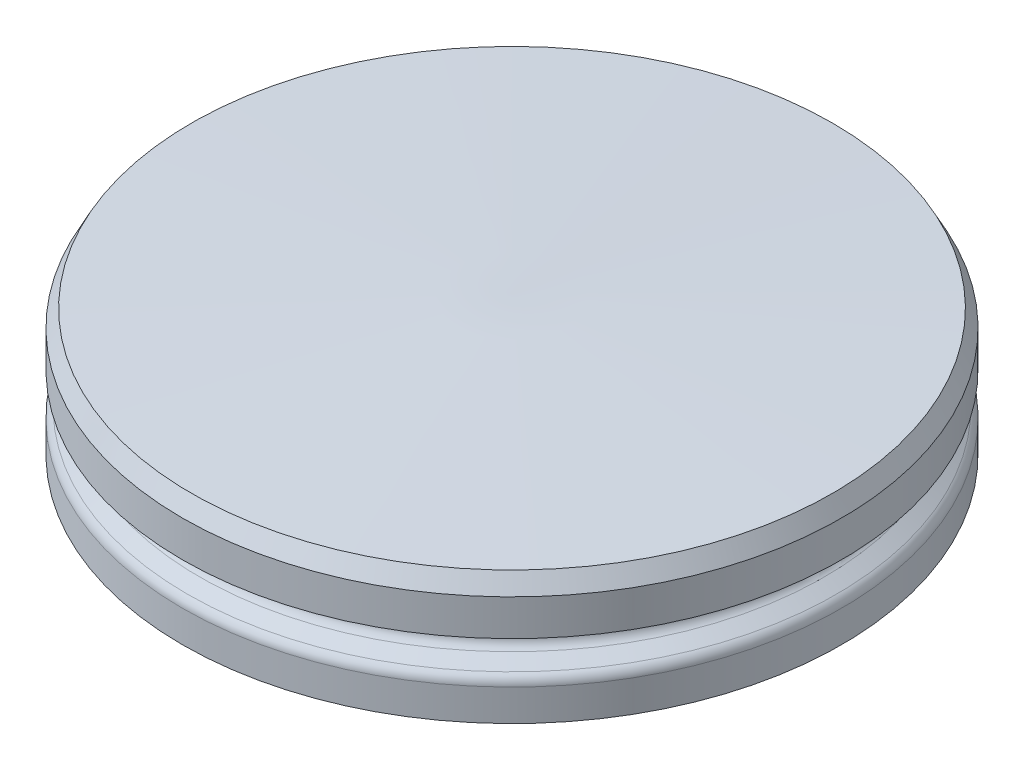
from build123d import *

# Parameters (mm, degrees)
FILLET1_R      = 2.54
CHAMFER1_SIZE  = 1.905
CHAMFER1_SIZE2 = 3.544462864


with BuildPart() as part:
    # Sketch1 → Revolve1 (revolve)
    with BuildSketch(Plane.XY, mode=Mode.PRIVATE) as revolve1_sk:
        Polygon((0, 0), (70.24917533, -2.772993763), (70.24917533, -14.029203884), (61.584078813, -15.473386637), (70.24917533, -21.662741291), (70.24917533, -29.708902342), (0, -26.935908579), align=None)
    revolve(revolve1_sk.sketch.rotate(Axis((0, -26.935908579, 0), (0, 1, 0)), 90), axis=Axis((0, -26.935908579, 0), (0, 1, 0)))

    # Fillet1
    fillet1_edges = [part.edges().sort_by_distance(p)[0] for p in [
        (0, -21.662741291, 70.24917533),
        (0, -15.473386637, 61.584078813),
    ]]
    fillet(fillet1_edges, radius=FILLET1_R)

    # Chamfer1
    chamfer1_edges = [part.edges().sort_by_distance(p)[0] for p in [
        (0, -2.772993763, 70.24917533),
    ]]
    chamfer1_side = [part.faces().sort_by_distance(p)[0] for p in [
        (0, -1.386496882, 35.124587665),
    ]]
    chamfer(chamfer1_edges, length=CHAMFER1_SIZE, length2=CHAMFER1_SIZE2, reference=chamfer1_side[0])


solid = part.part
